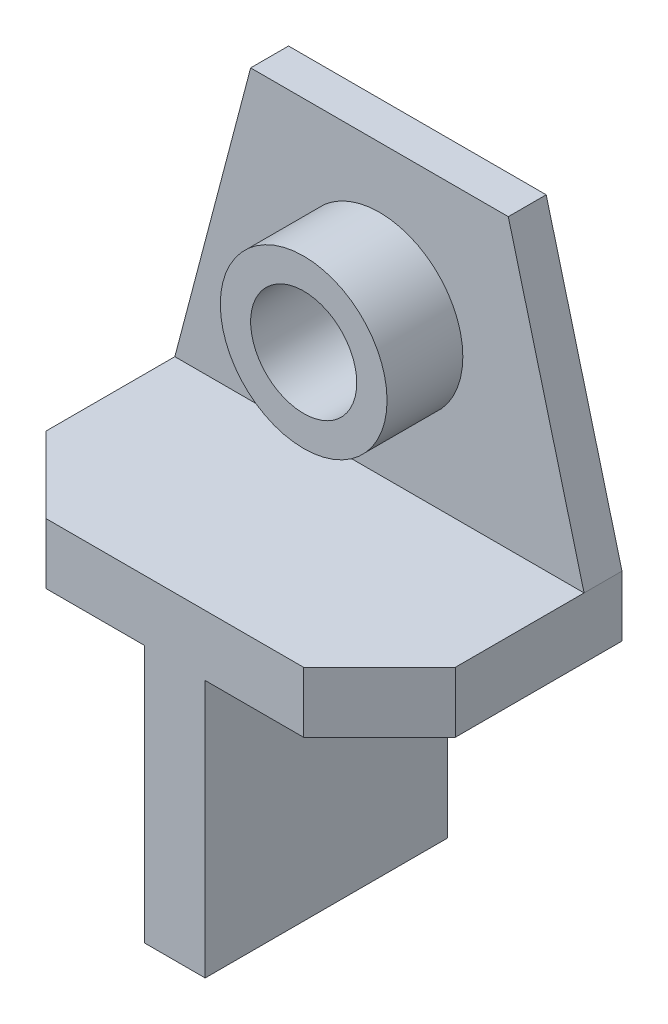
from build123d import *

# Parameters (mm, degrees)
BOSS_EXTRUDE1_DEPTH = 16
SKETCH3_W           = 54
SKETCH3_H           = 5
BOSS_EXTRUDE2_DEPTH = 38
CUT_EXTRUDE4_DEPTH  = 10
SKETCH10_R          = 11
SKETCH10_R_2        = 7
BOSS_EXTRUDE4_DEPTH = 10
CUT_EXTRUDE5_DEPTH  = 10


with BuildPart() as part:
    # Sketch1 → Boss-Extrude1 (new, symmetric)
    with BuildSketch(Plane.XY):
        Polygon((0, 0), (54, 0), (54, -8), (31, -8), (31, -42), (23, -42), (23, -8), (0, -8), align=None)
    extrude(amount=BOSS_EXTRUDE1_DEPTH, both=True)

    # Sketch3 → Boss-Extrude2 (add)
    with BuildSketch(Plane(origin=(0, 0, 0), x_dir=(1, 0, 0), z_dir=(0, 1, 0))):
        with Locations((27, 13.5)):
            Rectangle(SKETCH3_W, SKETCH3_H)
    extrude(amount=BOSS_EXTRUDE2_DEPTH)

    # Sketch5 → Cut-Extrude4 (cut)
    with BuildSketch(Plane(origin=(0, 0, 0), x_dir=(1, 0, 0), z_dir=(0, 1, 0))):
        Polygon((44, -16), (54, -6), (54, -16), align=None)
        Polygon((10, -16), (0, -6), (0, -16), align=None)
    extrude(amount=-CUT_EXTRUDE4_DEPTH, mode=Mode.SUBTRACT)

    # Sketch10 → Boss-Extrude4 (add)
    with BuildSketch(Plane.XY.offset(-11)):
        with Locations(Location((27, 19, 0), (0, 0, 180))):
            Circle(SKETCH10_R)
        with Locations((27, 19)):
            Circle(SKETCH10_R_2, mode=Mode.SUBTRACT)
    extrude(amount=BOSS_EXTRUDE4_DEPTH)

    # Sketch12 → Cut-Extrude5 (cut)
    with BuildSketch(Plane.XY.offset(-11)):
        Polygon((0, 0), (10, 38), (0, 38), align=None)
        Polygon((44, 38), (54, 38), (54, 0), align=None)
    extrude(amount=-CUT_EXTRUDE5_DEPTH, mode=Mode.SUBTRACT)


solid = part.part
